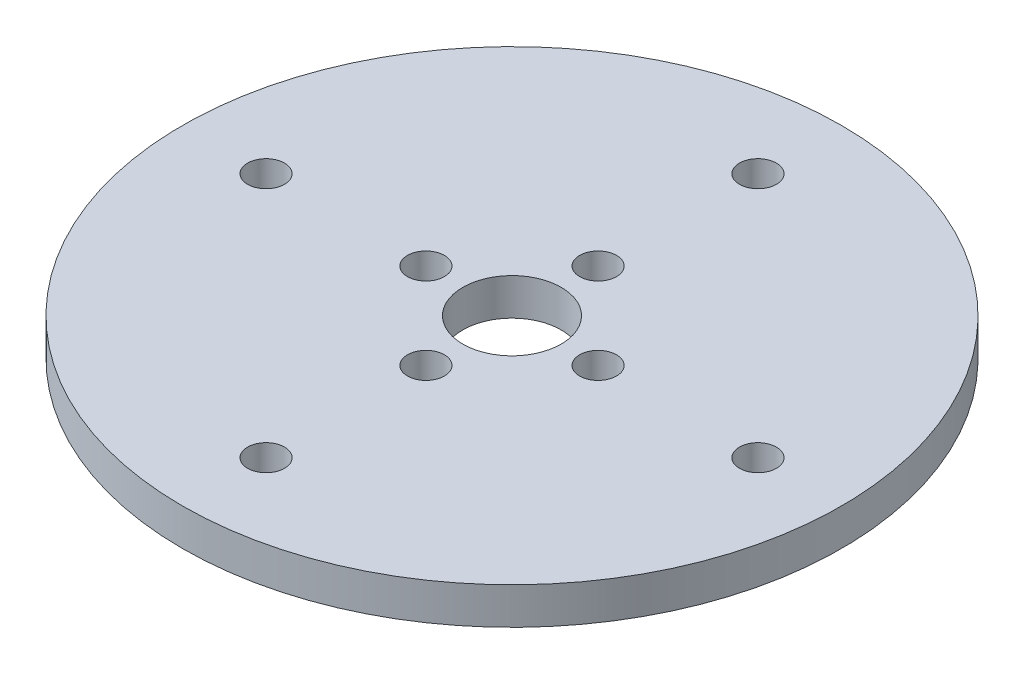
from build123d import *

# Parameters (mm, degrees)
SKETCH_1_R      = 26.8
SKETCH_1_R_2    = 4
SKETCH_1_R_3    = 1.5
EXTRUDE_2_DEPTH = 3


with BuildPart() as part:
    # 草图1 → 凸台-拉伸2 (new body)
    with BuildSketch(Plane(origin=(0, 0, 0), x_dir=(1, 0, 0), z_dir=(0, 1, 0))):
        with Locations(Location((0, 0, 0), (0, 0, 270))):
            Circle(SKETCH_1_R)
        with Locations(Location((0, 0, 0), (0, 0, 270))):
            Circle(SKETCH_1_R_2, mode=Mode.SUBTRACT)
        with Locations(Location((0, 20, 0), (0, 0, 270))):
            Circle(SKETCH_1_R_3, mode=Mode.SUBTRACT)
        with Locations(Location((-20, 0, 0), (0, 0, 270))):
            Circle(SKETCH_1_R_3, mode=Mode.SUBTRACT)
        with Locations(Location((-7, 0, 0), (0, 0, 270))):
            Circle(SKETCH_1_R_3, mode=Mode.SUBTRACT)
        with Locations(Location((0, 7, 0), (0, 0, 270))):
            Circle(SKETCH_1_R_3, mode=Mode.SUBTRACT)
        with Locations(Location((0, -7, 0), (0, 0, 270))):
            Circle(SKETCH_1_R_3, mode=Mode.SUBTRACT)
        with Locations(Location((0, -20, 0), (0, 0, 270))):
            Circle(SKETCH_1_R_3, mode=Mode.SUBTRACT)
        with Locations(Location((7, 0, 0), (0, 0, 270))):
            Circle(SKETCH_1_R_3, mode=Mode.SUBTRACT)
        with Locations(Location((20, 0, 0), (0, 0, 270))):
            Circle(SKETCH_1_R_3, mode=Mode.SUBTRACT)
    extrude(amount=EXTRUDE_2_DEPTH)


solid = part.part
